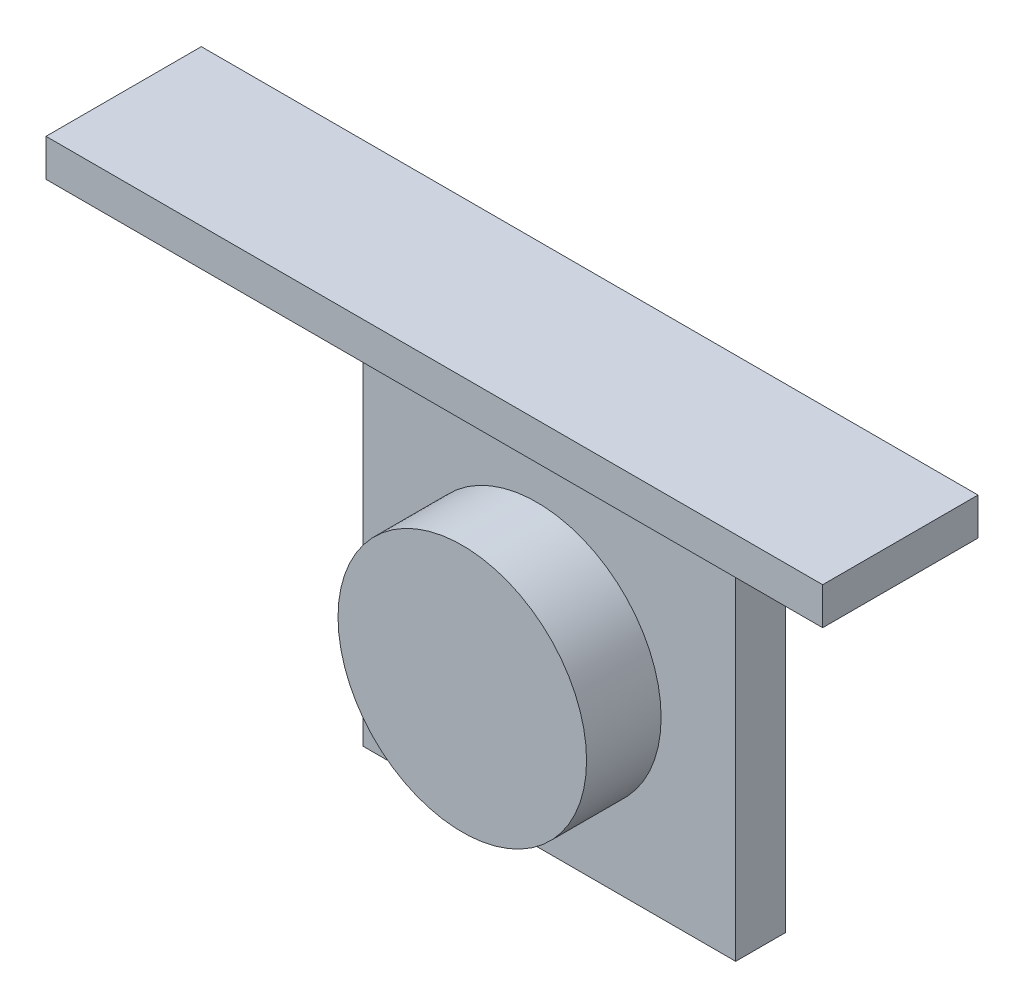
from build123d import *

# Parameters (mm, degrees)
WS2812_START                          = -0.8
SKETCH_1_W                            = 12
SKETCH_1_H                            = 12
WS2812_RGB_LED_BOARD_12_X_12_MM_DEPTH = 1.6
RGB_START                             = 1.2
SKETCH_2_R                            = 4
RGB_LED_DIFFUSER_DEPTH                = 2.4
LED_START                             = -0.5
SKETCH_3_W                            = 25
SKETCH_3_H                            = 1.2
LED_LABEL_PLATE_WS2812_DEPTH          = 5


with BuildPart() as part:
    # 草图1 → WS2812 RGB LED board - 12 x 12 mm (new body)
    with BuildSketch(Plane.XY.offset(WS2812_START)):
        Rectangle(SKETCH_1_W, SKETCH_1_H)
    extrude(amount=WS2812_RGB_LED_BOARD_12_X_12_MM_DEPTH)


with BuildPart() as body_2:
    # 草图2 → RGB LED diffuser (new body)
    with BuildSketch(Plane.XY.offset(RGB_START)):
        Circle(SKETCH_2_R)
    extrude(amount=RGB_LED_DIFFUSER_DEPTH)


with BuildPart() as body_3:
    # 草图3 → led label plate - WS2812 (new body)
    with BuildSketch(Plane.XY.offset(LED_START)):
        with Locations((0, 9)):
            Rectangle(SKETCH_3_W, SKETCH_3_H)
    extrude(amount=LED_LABEL_PLATE_WS2812_DEPTH)


solid = Compound([part.part, body_2.part, body_3.part])
